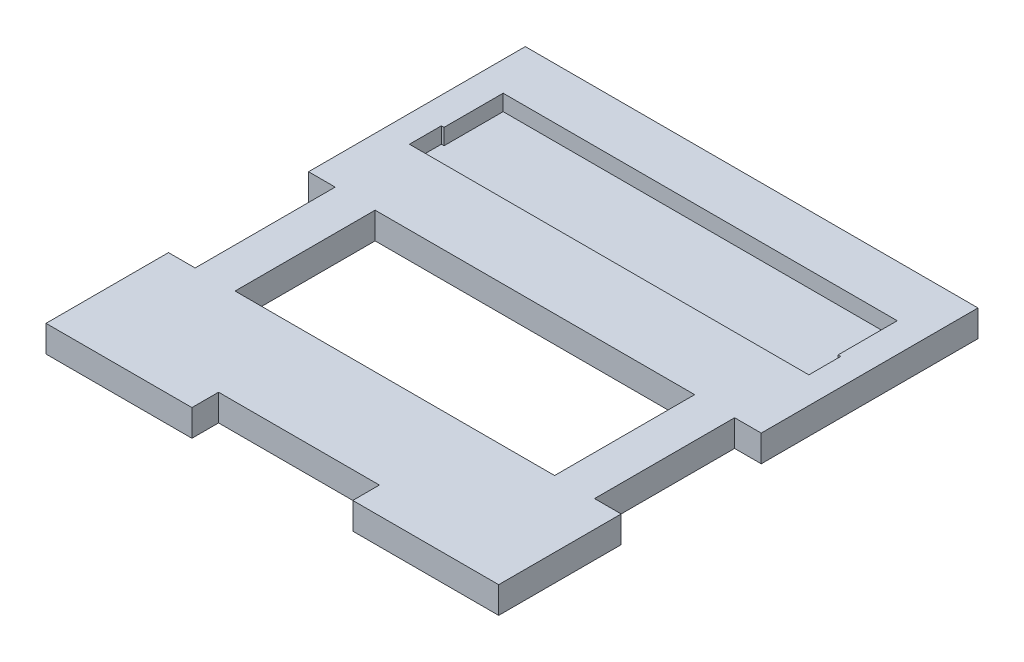
from build123d import *

# Parameters (mm, degrees)
SKETCH1_W           = 85
SKETCH1_H           = 90
BOSS_EXTRUDE1_DEPTH = 5
SKETCH2_W           = 60
SKETCH2_H           = 26.3
CUT_EXTRUDE2_DEPTH  = 7.5
SKETCH4_W           = 5
SKETCH4_H           = 26.3
CUT_EXTRUDE3_DEPTH  = 7.5
SKETCH5_W           = 30.2
SKETCH5_H           = 5
CUT_EXTRUDE4_DEPTH  = 5
CUT_EXTRUDE5_DEPTH  = 3


with BuildPart() as part:
    # Sketch1 → Boss-Extrude1 (new body)
    with BuildSketch(Plane(origin=(0, 0, 0), x_dir=(1, 0, 0), z_dir=(0, 1, 0))):
        Rectangle(SKETCH1_W, SKETCH1_H)
    extrude(amount=BOSS_EXTRUDE1_DEPTH)

    # Sketch2 → Cut-Extrude2 (cut)
    with BuildSketch(Plane(origin=(0, 5, 0), x_dir=(1, 0, 0), z_dir=(0, 1, 0))):
        with Locations((0, -8.85)):
            Rectangle(SKETCH2_W, SKETCH2_H)
    extrude(amount=-CUT_EXTRUDE2_DEPTH, mode=Mode.SUBTRACT)

    # Sketch4 → Cut-Extrude3 (cut)
    with BuildSketch(Plane(origin=(0, 5, 0), x_dir=(1, 0, 0), z_dir=(0, 1, 0))):
        with Locations((-40, -8.85)):
            Rectangle(SKETCH4_W, SKETCH4_H)
        with Locations((40, -8.85)):
            Rectangle(SKETCH4_W, SKETCH4_H)
    extrude(amount=-CUT_EXTRUDE3_DEPTH, mode=Mode.SUBTRACT)

    # Sketch5 → Cut-Extrude4 (cut)
    with BuildSketch(Plane(origin=(0, 5, 0), x_dir=(1, 0, 0), z_dir=(0, 1, 0))):
        with Locations((0, -42.5)):
            Rectangle(SKETCH5_W, SKETCH5_H)
    extrude(amount=-CUT_EXTRUDE4_DEPTH, mode=Mode.SUBTRACT)

    # Sketch6 → Cut-Extrude5 (cut)
    with BuildSketch(Plane(origin=(0, 5, 0), x_dir=(1, 0, 0), z_dir=(0, 1, 0))):
        Polygon((-37, 35.34), (37, 35.34), (37, 24.24), (37.5, 24.24), (37.5, 18.24), (-37.5, 18.24), (-37.5, 24.24), (-37, 24.24), align=None)
    extrude(amount=-CUT_EXTRUDE5_DEPTH, mode=Mode.SUBTRACT)


solid = part.part
